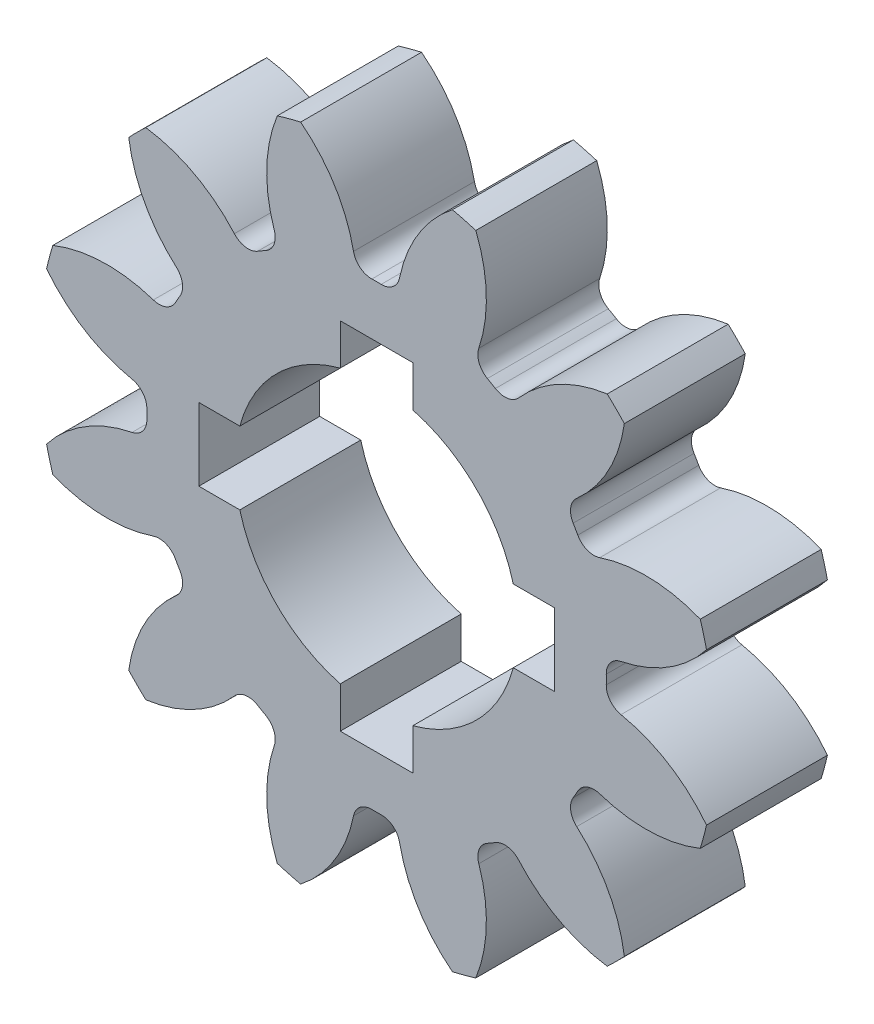
from build123d import *

# Parameters (mm, degrees)
SKETCH1_R                = 14
BOSS_EXTRUDE1_DEPTH      = 5
CUT_EXTRUDE1_DEPTH       = 10
FILLET2_R                = 0.76
CIRPATTERN2_COUNT        = 12
FILLET2_OF_CIRPATTERN2_R = 0.76
CUT_EXTRUDE2_DEPTH       = 5


with BuildPart() as part:
    # Sketch1 → Boss-Extrude1 (new body)
    with BuildSketch(Plane.XY):
        Circle(SKETCH1_R)
    extrude(amount=-BOSS_EXTRUDE1_DEPTH)

    # Sketch1<4> → Cut-Extrude1 (cut)
    with BuildSketch(Plane.XY):
        with BuildLine():
            ThreePointArc((-0.857546411, 9.461216315), (0, 9.5), (0.857546411, 9.461216315))
            ThreePointArc((0.857546411, 9.461216315), (1.564361536, 11.788884259), (3.138269843, 13.643726118))
            ThreePointArc((3.138269843, 13.643726118), (0, 14), (-3.138269843, 13.643726118))
            ThreePointArc((-3.138269843, 13.643726118), (-1.564361536, 11.788884259), (-0.857546411, 9.461216315))
        make_face()
    cut_extrude1 = extrude(amount=-CUT_EXTRUDE1_DEPTH, mode=Mode.SUBTRACT)

    # Fillet2
    fillet2_edges = [part.edges().sort_by_distance(p)[0] for p in [
        (0.857546411, 9.461216315, -2.5),
        (-0.857546411, 9.461216315, -2.5),
    ]]
    fillet(fillet2_edges, radius=FILLET2_R)

    # CirPattern2: Cut-Extrude1 ×12 about axis
    cirpattern2_axis = Axis((0, 0, 0), (0, 0, 1))
    for i in range(1, CIRPATTERN2_COUNT):
        add(cut_extrude1.rotate(cirpattern2_axis, i * 360 / CIRPATTERN2_COUNT), mode=Mode.SUBTRACT)

    # Fillet2 of CirPattern2
    fillet2_of_cirpattern2_edges = [part.edges().sort_by_distance(p)[0] for p in [
        (-3.98795118, 8.622426885, -2.5),
        (-5.473265134, 7.764880474, -2.5),
        (-7.764880474, 5.473265134, -2.5),
        (-8.622426885, 3.98795118, -2.5),
        (-9.461216315, 0.857546411, -2.5),
        (-9.461216315, -0.857546411, -2.5),
        (-8.622426885, -3.98795118, -2.5),
        (-7.764880474, -5.473265134, -2.5),
        (-5.473265134, -7.764880474, -2.5),
        (-3.98795118, -8.622426885, -2.5),
        (-0.857546411, -9.461216315, -2.5),
        (0.857546411, -9.461216315, -2.5),
        (3.98795118, -8.622426885, -2.5),
        (5.473265134, -7.764880474, -2.5),
        (7.764880474, -5.473265134, -2.5),
        (8.622426885, -3.98795118, -2.5),
        (9.461216315, -0.857546411, -2.5),
        (9.461216315, 0.857546411, -2.5),
        (8.622426885, 3.98795118, -2.5),
        (7.764880474, 5.473265134, -2.5),
        (5.473265134, 7.764880474, -2.5),
        (3.98795118, 8.622426885, -2.5),
    ]]
    fillet(fillet2_of_cirpattern2_edges, radius=FILLET2_OF_CIRPATTERN2_R)

    # Sketch2 → Cut-Extrude2 (cut)
    with BuildSketch(Plane.XY):
        with BuildLine():
            Line((-1.5, 5.652839314), (-1.5, 7.348469228))
            Line((-1.5, 7.348469228), (1.5, 7.348469228))
            Line((1.5, 7.348469228), (1.5, 5.652839314))
            ThreePointArc((1.5, 5.652839314), (4.135492251, 4.135492251), (5.652839314, 1.5))
            Line((5.652839314, 1.5), (7.348469228, 1.5))
            Line((7.348469228, 1.5), (7.348469228, -1.5))
            Line((7.348469228, -1.5), (5.652839314, -1.5))
            ThreePointArc((5.652839314, -1.5), (4.135492251, -4.135492251), (1.5, -5.652839314))
            Line((1.5, -5.652839314), (1.5, -7.348469228))
            Line((1.5, -7.348469228), (-1.5, -7.348469228))
            Line((-1.5, -7.348469228), (-1.5, -5.652839314))
            ThreePointArc((-1.5, -5.652839314), (-4.135492251, -4.135492251), (-5.652839314, -1.5))
            Line((-5.652839314, -1.5), (-7.348469228, -1.5))
            Line((-7.348469228, -1.5), (-7.348469228, 1.5))
            Line((-7.348469228, 1.5), (-5.652839314, 1.5))
            ThreePointArc((-5.652839314, 1.5), (-4.135492251, 4.135492251), (-1.5, 5.652839314))
        make_face()
    extrude(amount=-CUT_EXTRUDE2_DEPTH, mode=Mode.SUBTRACT)


solid = part.part
